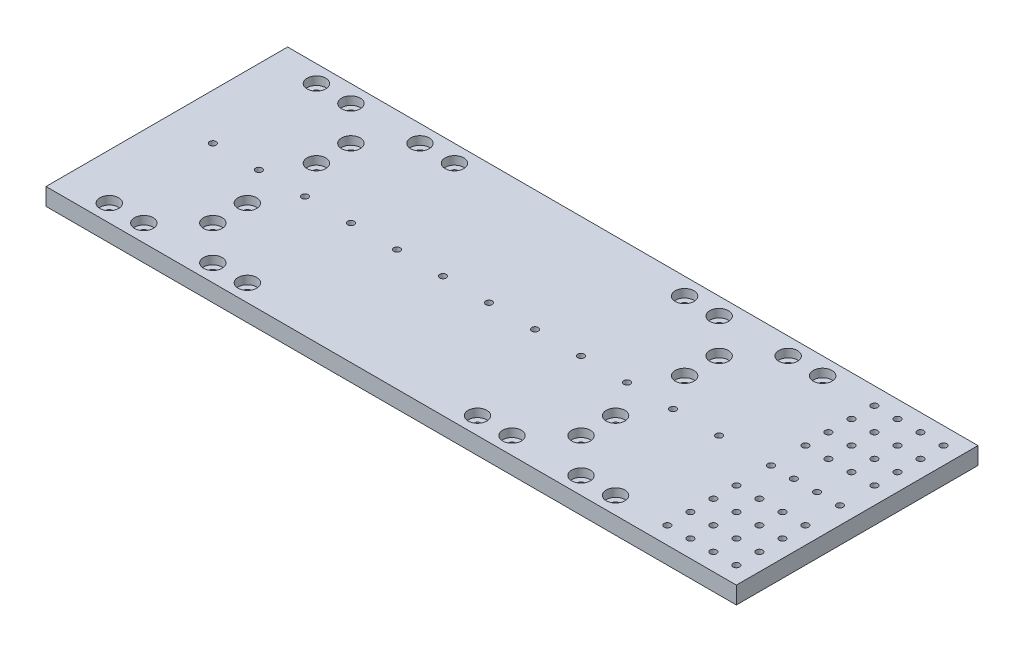
from build123d import *

# Parameters (mm, degrees)
SKETCH1_W                                 = 762
SKETCH1_H                                 = 266.7
BOSS_EXTRUDE1_DEPTH                       = 19.05
CBORE_FOR_5_16_HEX_HEAD_BOLT1_D           = 8.4328
CBORE_FOR_5_16_HEX_HEAD_BOLT1_CBORE_D     = 20.6375
CBORE_FOR_5_16_HEX_HEAD_BOLT1_CBORE_DEPTH = 9.144
F_1_4_CLEARANCE_HOLE1_D                   = 7.14248


with BuildPart() as part:
    # Sketch1 → Boss-Extrude1 (new body)
    with BuildSketch(Plane(origin=(0, 0, 0), x_dir=(1, 0, 0), z_dir=(0, 1, 0))):
        Rectangle(SKETCH1_W, SKETCH1_H)
    extrude(amount=BOSS_EXTRUDE1_DEPTH)

    # CBORE for 5/16 Hex Head Bolt1 (through all)
    with Locations(Plane(origin=(0, 19.05, 0), x_dir=(1, 0, 0), z_dir=(0, 1, 0))):
        with Locations((-330.2, 114.3), (-292.1, 114.3), (-254, 76.2), (-254, 38.1), (-215.9, 114.3), (-177.8, 114.3), (76.2, 114.3), (114.3, 114.3), (152.4, 76.2), (152.4, 38.1), (190.5, 114.3), (228.6, 114.3), (228.6, -114.3), (190.5, -114.3), (152.4, -38.1), (152.4, -76.2), (114.3, -114.3), (76.2, -114.3), (-177.8, -114.3), (-215.9, -114.3), (-254, -38.1), (-254, -76.2), (-292.1, -114.3), (-330.2, -114.3)):
            CounterBoreHole(CBORE_FOR_5_16_HEX_HEAD_BOLT1_D / 2, CBORE_FOR_5_16_HEX_HEAD_BOLT1_CBORE_D / 2, CBORE_FOR_5_16_HEX_HEAD_BOLT1_CBORE_DEPTH)

    # 1/4 Clearance Hole1 (through all)
    with Locations(Plane(origin=(0, 19.05, 0), x_dir=(1, 0, 0), z_dir=(0, 1, 0))):
        with Locations((-330.2, 0), (-279.4, 0), (-228.6, 0), (-177.8, 0), (-127, 0), (-76.2, 0), (-25.4, 0), (25.4, 0), (76.2, 0), (127, 0), (177.8, 0), (228.6, 0), (361.95, 114.3), (336.55, 114.3), (311.15, 114.3), (285.75, 114.3), (336.55, 88.9), (311.15, 88.9), (285.75, 88.9), (336.55, 63.5), (311.15, 63.5), (285.75, 63.5), (336.55, 38.1), (311.15, 38.1), (285.75, 38.1), (336.55, -38.1), (311.15, -38.1), (285.75, -38.1), (336.55, -63.5), (311.15, -63.5), (285.75, -63.5), (336.55, -88.9), (311.15, -88.9), (285.75, -88.9), (336.55, -114.3), (311.15, -114.3), (285.75, -114.3), (361.95, 88.9), (361.95, 63.5), (361.95, 38.1), (361.95, -38.1), (361.95, -63.5), (361.95, -88.9), (361.95, -114.3), (361.95, 0), (336.55, 0), (311.15, 0), (285.75, 0)):
            Hole(F_1_4_CLEARANCE_HOLE1_D / 2)


solid = part.part
